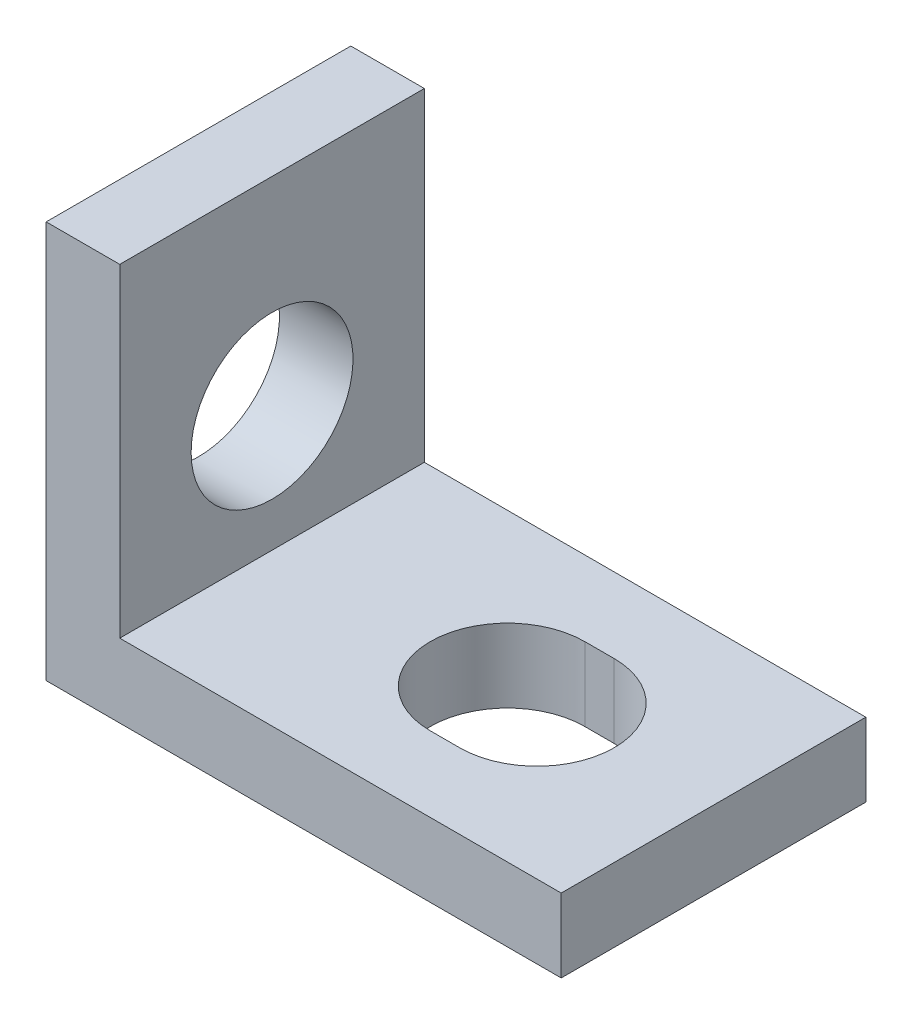
from build123d import *

# Parameters (mm, degrees)
EXTRUDE_1_DEPTH     = 4.14
SKETCH_3_R          = 1.1
CUT_EXTRUDE_1_DEPTH = 10.762151402
CUT_EXTRUDE_2_DEPTH = 10.762151402


with BuildPart() as part:
    # 草图1 → 凸台-拉伸1 (new body)
    with BuildSketch(Plane.XY):
        Polygon((0, 0), (0, 5.4), (1, 5.4), (1, 1), (7, 1), (7, 0), align=None)
    extrude(amount=EXTRUDE_1_DEPTH)

    # 草图3 → 切除-拉伸1 (cut, through all)
    with BuildSketch(Plane.ZY):
        with Locations((2.07, 2.7)):
            Circle(SKETCH_3_R)
    extrude(amount=-CUT_EXTRUDE_1_DEPTH, mode=Mode.SUBTRACT)

    # 草图4 → 切除-拉伸2 (cut, through all)
    with BuildSketch(Plane.XZ):
        with BuildLine():
            Line((4.6, 1.02), (4.2, 1.02))
            ThreePointArc((4.2, 1.02), (3.15, 2.07), (4.2, 3.12))
            Line((4.2, 3.12), (4.6, 3.12))
            ThreePointArc((4.6, 3.12), (5.65, 2.07), (4.6, 1.02))
        make_face()
    extrude(amount=-CUT_EXTRUDE_2_DEPTH, mode=Mode.SUBTRACT)


solid = part.part
